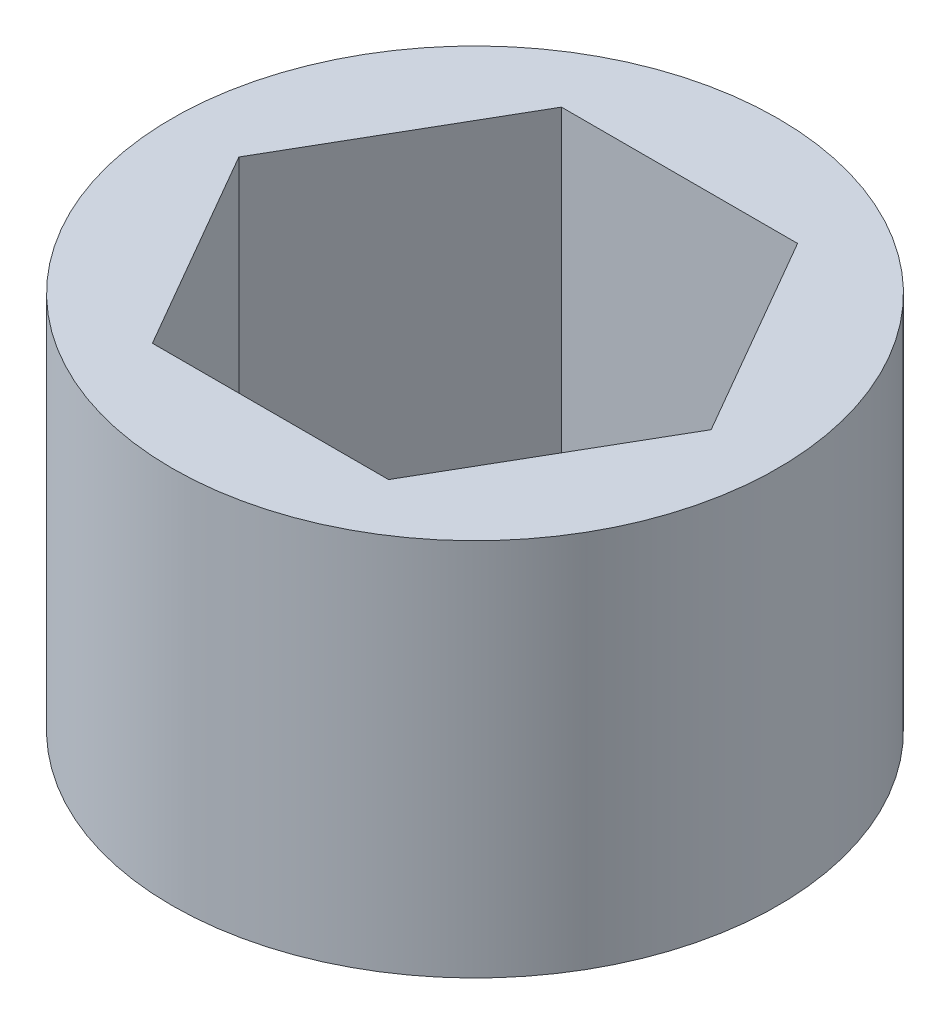
from build123d import *

# Parameters (mm, degrees)
SKETCH1_R           = 10.16
BOSS_EXTRUDE1_DEPTH = 12.7


with BuildPart() as part:
    # Sketch1 → Boss-Extrude1 (new body)
    with BuildSketch(Plane(origin=(0, 0, 0), x_dir=(1, 0, 0), z_dir=(0, 1, 0))):
        with Locations(Location((0, 0, 0), (0, 0, 270))):
            Circle(SKETCH1_R)
        Polygon((7.918936292, 0), (3.959468146, 6.858), (-3.959468146, 6.858), (-7.918936292, 0), (-3.959468146, -6.858), (3.959468146, -6.858), align=None, mode=Mode.SUBTRACT)
    extrude(amount=BOSS_EXTRUDE1_DEPTH)


solid = part.part
